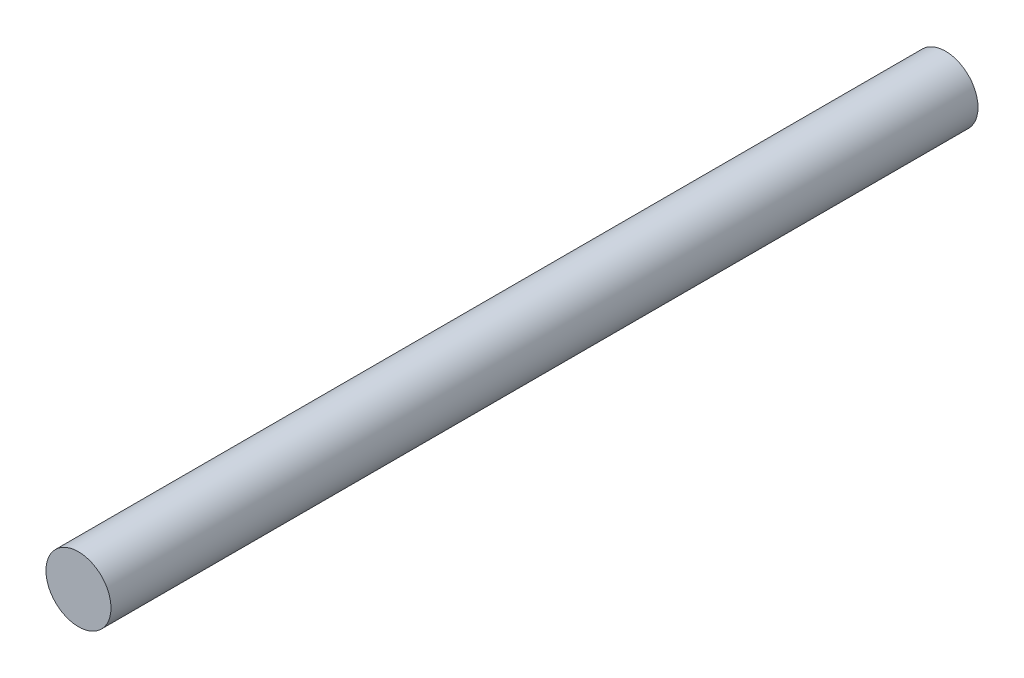
from build123d import *

# Parameters (mm, degrees)
SKETCH_1_R      = 3
EXTRUDE_1_DEPTH = 80


with BuildPart() as part:
    # 草圖1 → 填料-伸長1 (new body)
    with BuildSketch(Plane.XY):
        Circle(SKETCH_1_R)
    extrude(amount=EXTRUDE_1_DEPTH)


solid = part.part
